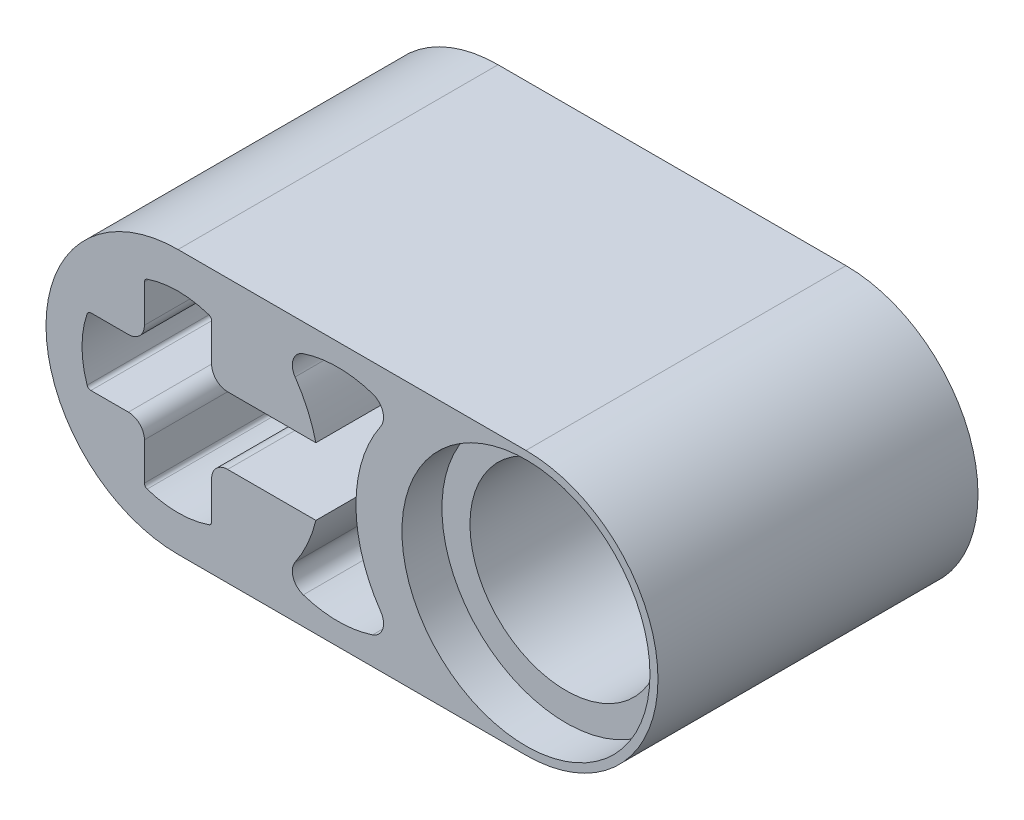
from build123d import *

# Parameters (mm, degrees)
SKETCH2_R           = 2.4
BOSS_EXTRUDE1_DEPTH = 8
SKETCH3_R           = 3.1
CUT_EXTRUDE1_DEPTH  = 1


with BuildPart() as part:
    # Sketch2 → Boss-Extrude1 (new body)
    with BuildSketch(Plane.XY):
        with BuildLine():
            Line((3.9, 3.3), (-4.797530266, 3.3))
            ThreePointArc((-4.797530266, 3.3), (-8.097530266, 0), (-4.797530266, -3.3))
            Line((-4.797530266, -3.3), (3.9, -3.3))
            ThreePointArc((3.9, -3.3), (7.2, 0), (3.9, 3.3))
        make_face()
        with Locations((3.9, 0)):
            Circle(SKETCH2_R, mode=Mode.SUBTRACT)
        with BuildLine():
            Line((-6.975235481, 0.84), (-6.037530266, 0.84))
            ThreePointArc((-6.037530266, 0.84), (-5.754687554, 0.957157288), (-5.637530266, 1.24))
            Line((-5.637530266, 1.24), (-5.637530266, 2.177705214))
            ThreePointArc((-5.637530266, 2.177705214), (-5.618824151, 2.235940121), (-5.56970418, 2.27238805))
            ThreePointArc((-5.56970418, 2.27238805), (-4.797530266, 2.4), (-4.025356353, 2.27238805))
            ThreePointArc((-4.025356353, 2.27238805), (-3.976236382, 2.235940121), (-3.957530266, 2.177705214))
            Line((-3.957530266, 2.177705214), (-3.957530266, 1.24))
            ThreePointArc((-3.957530266, 1.24), (-3.840372979, 0.957157288), (-3.557530266, 0.84))
            Line((-3.557530266, 0.84), (-2.619825052, 0.84))
            Line((-2.619825052, 0.84), (-2.549330987, 0.84))
            Line((-2.549330987, 0.84), (-1.35081169, 0.84))
            ThreePointArc((-1.35081169, 0.84), (-1.557752494, 1.445797742), (-1.870126582, 2.004580194))
            ThreePointArc((-1.870126582, 2.004580194), (-1.919033599, 2.358251088), (-1.665957447, 2.610099174))
            ThreePointArc((-1.665957447, 2.610099174), (-0.8, 2.75), (0.065957447, 2.610099174))
            ThreePointArc((0.065957447, 2.610099174), (0.319033599, 2.358251088), (0.270126582, 2.004580194))
            ThreePointArc((0.270126582, 2.004580194), (-0.35, 0), (0.270126582, -2.004580194))
            ThreePointArc((0.270126582, -2.004580194), (0.319033599, -2.358251088), (0.065957447, -2.610099174))
            ThreePointArc((0.065957447, -2.610099174), (-0.8, -2.75), (-1.665957447, -2.610099174))
            ThreePointArc((-1.665957447, -2.610099174), (-1.919033599, -2.358251088), (-1.870126582, -2.004580194))
            ThreePointArc((-1.870126582, -2.004580194), (-1.557752494, -1.445797742), (-1.35081169, -0.84))
            Line((-1.35081169, -0.84), (-2.549330987, -0.84))
            Line((-2.549330987, -0.84), (-2.619825052, -0.84))
            Line((-2.619825052, -0.84), (-3.557530266, -0.84))
            ThreePointArc((-3.557530266, -0.84), (-3.840372979, -0.957157288), (-3.957530266, -1.24))
            Line((-3.957530266, -1.24), (-3.957530266, -2.177705214))
            ThreePointArc((-3.957530266, -2.177705214), (-3.976236382, -2.235940121), (-4.025356353, -2.27238805))
            ThreePointArc((-4.025356353, -2.27238805), (-4.797530266, -2.4), (-5.56970418, -2.27238805))
            ThreePointArc((-5.56970418, -2.27238805), (-5.618824151, -2.235940121), (-5.637530266, -2.177705214))
            Line((-5.637530266, -2.177705214), (-5.637530266, -1.24))
            ThreePointArc((-5.637530266, -1.24), (-5.754687554, -0.957157288), (-6.037530266, -0.84))
            Line((-6.037530266, -0.84), (-6.975235481, -0.84))
            ThreePointArc((-6.975235481, -0.84), (-7.033470387, -0.821293884), (-7.069918316, -0.772173913))
            ThreePointArc((-7.069918316, -0.772173913), (-7.197530266, 0), (-7.069918316, 0.772173913))
            ThreePointArc((-7.069918316, 0.772173913), (-7.033470387, 0.821293884), (-6.975235481, 0.84))
        make_face(mode=Mode.SUBTRACT)
    extrude(amount=BOSS_EXTRUDE1_DEPTH)

    # Sketch3 → Cut-Extrude1 (cut)
    with BuildSketch(Plane.XY.offset(8)):
        with Locations((3.9, 0)):
            Circle(SKETCH3_R)
    cut_extrude1 = extrude(amount=-CUT_EXTRUDE1_DEPTH, mode=Mode.SUBTRACT)

    # Mirror1: Cut-Extrude1 across plane
    add(cut_extrude1.mirror(Plane.XY.offset(4)), mode=Mode.SUBTRACT)


solid = part.part
